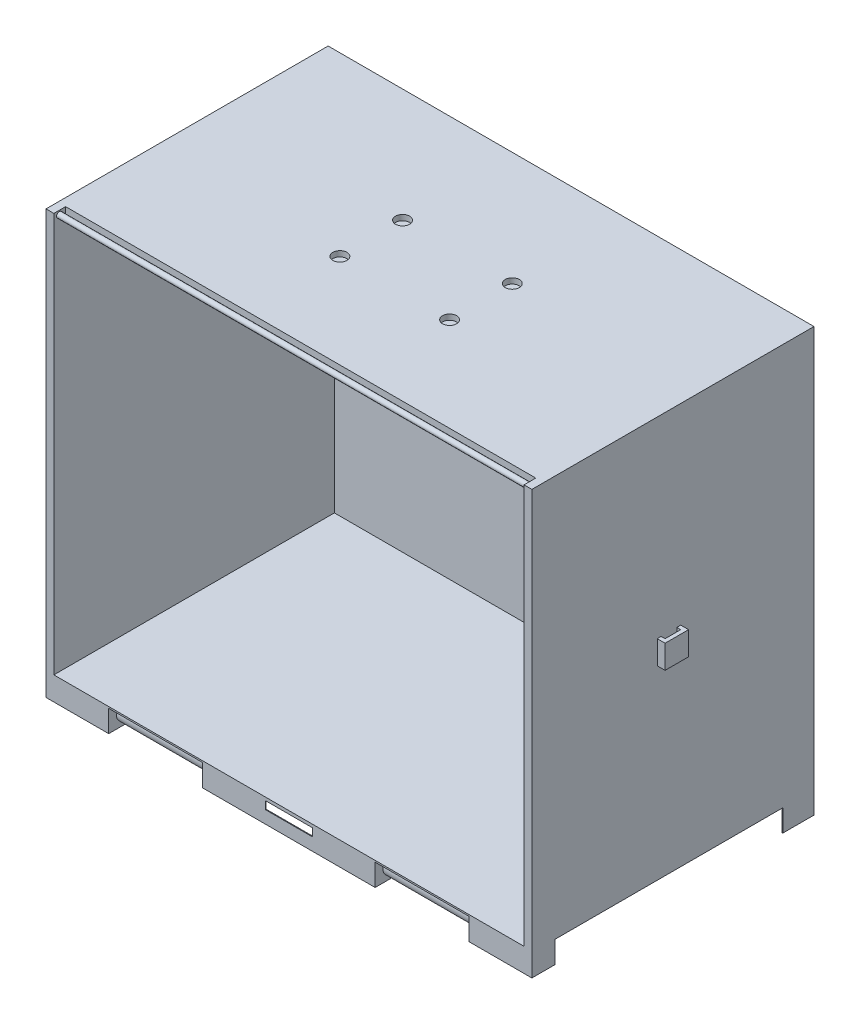
from build123d import *

# Parameters (mm, degrees)
SKETCH1_W                                  = 600
SKETCH1_H                                  = 500
BOSS_EXTRUDE1_DEPTH                        = 175
SHELL1_T                                   = 10
SKETCH3_W                                  = 620
SKETCH3_H                                  = 360
BOSS_EXTRUDE2_DEPTH                        = 20
SKETCH5_W                                  = 120
SKETCH5_H                                  = 150
CUT_EXTRUDE1_DEPTH                         = 50
BOSS_EXTRUDE3_DEPTH                        = 15
SKETCH9_R                                  = 10
SKETCH9_R_2                                = 8.804977656
SKETCH9_R_3                                = 9.206937975
BOSS_EXTRUDE4_DEPTH                        = 180
BOSS_EXTRUDE8_START                        = -260
BOSS_EXTRUDE8_DEPTH                        = 10
SKETCH147_W                                = 600
SKETCH147_H                                = 15
CUT_EXTRUDE2_DEPTH                         = 10
SKETCH148_R                                = 3.5
BOSS_EXTRUDE10_DEPTH                       = 600
SKETCH149_R                                = 9
CUT_EXTRUDE3_DEPTH                         = 7
MIRROR3_AT_THE_SECOND_PLANE_COPY_1_SKETC_R = 9
MIRROR3_AT_THE_SECOND_PLANE_COPY_1_DEPTH   = 7
SKETCH150_W                                = 60
SKETCH150_H                                = 10
CUT_EXTRUDE4_DEPTH                         = 30
CUT_EXTRUDE10_DEPTH                        = 28
SKETCH155_W                                = 290.489530142
SKETCH155_H                                = 28
CUT_EXTRUDE11_DEPTH                        = 716.53321378
BOSS_EXTRUDE11_DEPTH                       = 488
BOSS_EXTRUDE12_DEPTH                       = 125
BOSS_EXTRUDE12_DEPTH_BACK                  = 445
SKETCH160_W                                = 600
SKETCH160_H                                = 500
CUT_EXTRUDE12_DEPTH                        = 8


with BuildPart() as part:
    # Sketch1 → Boss-Extrude1 (new, symmetric)
    with BuildSketch(Plane.XY):
        Rectangle(SKETCH1_W, SKETCH1_H)
    extrude(amount=BOSS_EXTRUDE1_DEPTH, both=True)

    # Shell1
    shell1_openings = [part.faces().sort_by_distance(p)[0] for p in [
        (0, 0, 175),
    ]]
    offset(amount=SHELL1_T, openings=shell1_openings, kind=Kind.INTERSECTION)

    # Sketch3 → Boss-Extrude2 (add)
    with BuildSketch(Plane.XZ.offset(260)):
        with Locations((0, -5)):
            Rectangle(SKETCH3_W, SKETCH3_H)
    extrude(amount=BOSS_EXTRUDE2_DEPTH)

    # Sketch5 → Cut-Extrude1 (cut)
    with BuildSketch(Plane.XZ.offset(280)):
        with Locations((-170, 100)):
            Rectangle(SKETCH5_W, SKETCH5_H)
        with Locations((170, 100)):
            Rectangle(SKETCH5_W, SKETCH5_H)
        with Locations((-220, -185)):
            Rectangle(SKETCH5_W, SKETCH5_H)
        with Locations((220, -185)):
            Rectangle(SKETCH5_W, SKETCH5_H)
    extrude(amount=-CUT_EXTRUDE1_DEPTH, mode=Mode.SUBTRACT)

    # Sketch8 → Boss-Extrude3 (add, symmetric)
    with BuildSketch(Plane(origin=(0, 0, 0), x_dir=(1, 0, 0), z_dir=(0, 1, 0))):
        Polygon((-310, 10), (-315, 10), (-315, -10), (-310, -10), (-310, -15), (-320, -15), (-320, 15), (-310, 15), align=None)
    boss_extrude3 = extrude(amount=BOSS_EXTRUDE3_DEPTH, both=True)

    # Sketch9 → Boss-Extrude4 (add)
    # profile 1 of 2: a face of its own
    with BuildSketch(Plane.ZY.offset(110)):
        with Locations(Location((155, -265, 0), (0, 0, 180))):
            Circle(SKETCH9_R)
        with Locations((155, -265)):
            Circle(SKETCH9_R_2, mode=Mode.SUBTRACT)
    # profile 2 of 2: a face of its own
    with BuildSketch(Plane.ZY.offset(110)):
        with Locations(Location((-165, -265, 0), (0, 0, 180))):
            Circle(SKETCH9_R)
        with Locations(Location((-165, -265, 0), (0, 0, 180))):
            Circle(SKETCH9_R_3, mode=Mode.SUBTRACT)
    boss_extrude4 = extrude(amount=BOSS_EXTRUDE4_DEPTH)

    # Mirror1: Boss-Extrude3, Boss-Extrude4 across plane
    add(boss_extrude3.mirror(Plane(origin=(0, 0, 0), x_dir=(0, 0, 1), z_dir=(1, 0, 0))))
    add(boss_extrude4.mirror(Plane(origin=(0, 0, 0), x_dir=(0, 0, 1), z_dir=(1, 0, 0))))

    # Sketch17 → Boss-Extrude8 (add, symmetric)
    with BuildSketch(Plane(origin=(0, 260, 0), x_dir=(1, 0, 0), z_dir=(0, 1, 0)).offset(BOSS_EXTRUDE8_START)):
        Polygon((-194.223256177, 185), (-204.223256177, 185), (-204.223256177, 191.540544069), (-159.461030104, 191.540544069), (-159.461030104, 185), (-169.461030104, 185), (-169.461030104, 188.442858537), (-194.223256177, 188.442858537), align=None)
        Polygon((194.223256177, 188.442858537), (194.223256177, 185), (204.223256177, 185), (204.223256177, 191.540544069), (159.461030104, 191.540544069), (159.461030104, 185), (169.461030104, 185), (169.461030104, 188.442858537), align=None)
    extrude(amount=BOSS_EXTRUDE8_DEPTH, both=True)

    # Sketch147 → Cut-Extrude2 (cut)
    with BuildSketch(Plane(origin=(0, 260, 0), x_dir=(1, 0, 0), z_dir=(0, 1, 0))):
        with Locations((0, -167.5)):
            Rectangle(SKETCH147_W, SKETCH147_H)
    extrude(amount=-CUT_EXTRUDE2_DEPTH, mode=Mode.SUBTRACT)

    # Sketch148 → Boss-Extrude10 (add)
    with BuildSketch(Plane(origin=(-300, 0, 0), x_dir=(0, 0, -1), z_dir=(1, 0, 0))):
        with Locations(Location((-168, 255, 0), (0, 0, 180))):
            Circle(SKETCH148_R)
    extrude(amount=BOSS_EXTRUDE10_DEPTH)

    # Sketch149 → Cut-Extrude3 (cut)
    with BuildSketch(Plane(origin=(0, 260, 0), x_dir=(1, 0, 0), z_dir=(0, 1, 0))):
        with Locations(Location((-70, 40, 0), (0, 0, 270))):
            Circle(SKETCH149_R)
    cut_extrude3 = extrude(amount=-CUT_EXTRUDE3_DEPTH, mode=Mode.SUBTRACT)

    # Mirror3: Cut-Extrude3 across plane
    add(cut_extrude3.mirror(Plane.XY), mode=Mode.SUBTRACT)

    # Mirror3 at the second plane: Cut-Extrude3 across plane
    add(cut_extrude3.mirror(Plane(origin=(0, 0, 0), x_dir=(0, 0, 1), z_dir=(1, 0, 0))), mode=Mode.SUBTRACT)

    # Mirror3 at the second plane copy 1 sketc → Mirror3 at the second plane copy 1 (cut)
    with BuildSketch(Plane(origin=(0, 260, 0), x_dir=(-1, 0, 0), z_dir=(0, 1, 0))):
        with Locations(Location((-70, 40, 0), (0, 0, 270))):
            Circle(MIRROR3_AT_THE_SECOND_PLANE_COPY_1_SKETC_R)
    extrude(amount=-MIRROR3_AT_THE_SECOND_PLANE_COPY_1_DEPTH, mode=Mode.SUBTRACT)

    # Sketch150 → Cut-Extrude4 (cut)
    with BuildSketch(Plane.XY.offset(175)):
        with Locations((0, -259)):
            Rectangle(SKETCH150_W, SKETCH150_H)
    extrude(amount=-CUT_EXTRUDE4_DEPTH, mode=Mode.SUBTRACT)

    # Sketch154 → Cut-Extrude10 (cut)
    with BuildSketch(Plane.XZ.offset(280)):
        Polygon((309, -184), (309, 174), (231, 174), (231, 24), (109, 24), (109, 174), (-109, 174), (-109, 24), (-231, 24), (-231, 174), (-309, 174), (-309, -184), (-281, -184), (-281, -109), (-159, -109), (-159, -184), (159, -184), (159, -109), (281, -109), (281, -184), align=None)
    extrude(amount=-CUT_EXTRUDE10_DEPTH, mode=Mode.SUBTRACT)

    # Sketch155 → Cut-Extrude11 (cut, through all)
    with BuildSketch(Plane.ZY.offset(310)):
        with Locations((0, -266)):
            Rectangle(SKETCH155_W, SKETCH155_H)
    extrude(amount=-CUT_EXTRUDE11_DEPTH, mode=Mode.SUBTRACT)

    # Sketch157 → Boss-Extrude11 (add)
    with BuildSketch(Plane(origin=(-230, 0, 0), x_dir=(0, 0, -1), z_dir=(1, 0, 0))):
        Polygon((-145.244765071, -252), (-175, -252), (-175, -250), (-25, -250), (-25, -252), align=None)
    extrude(amount=BOSS_EXTRUDE11_DEPTH)

    # Sketch159 → Boss-Extrude12 (add, two sides: drawn at the far end of the back side and taken through both)
    with BuildSketch(Plane(origin=(160, 0, 0), x_dir=(0, 0, -1), z_dir=(1, 0, 0)).offset(-BOSS_EXTRUDE12_DEPTH_BACK)):
        Polygon((145.244765071, -252), (185, -252), (185, -230), (175, -230), (175, -250), (110, -250), (110, -252), align=None)
    extrude(amount=BOSS_EXTRUDE12_DEPTH + BOSS_EXTRUDE12_DEPTH_BACK)

    # Sketch160 → Cut-Extrude12 (cut)
    with BuildSketch(Plane.XY.offset(-175)):
        Rectangle(SKETCH160_W, SKETCH160_H)
    extrude(amount=-CUT_EXTRUDE12_DEPTH, mode=Mode.SUBTRACT)


solid = part.part
